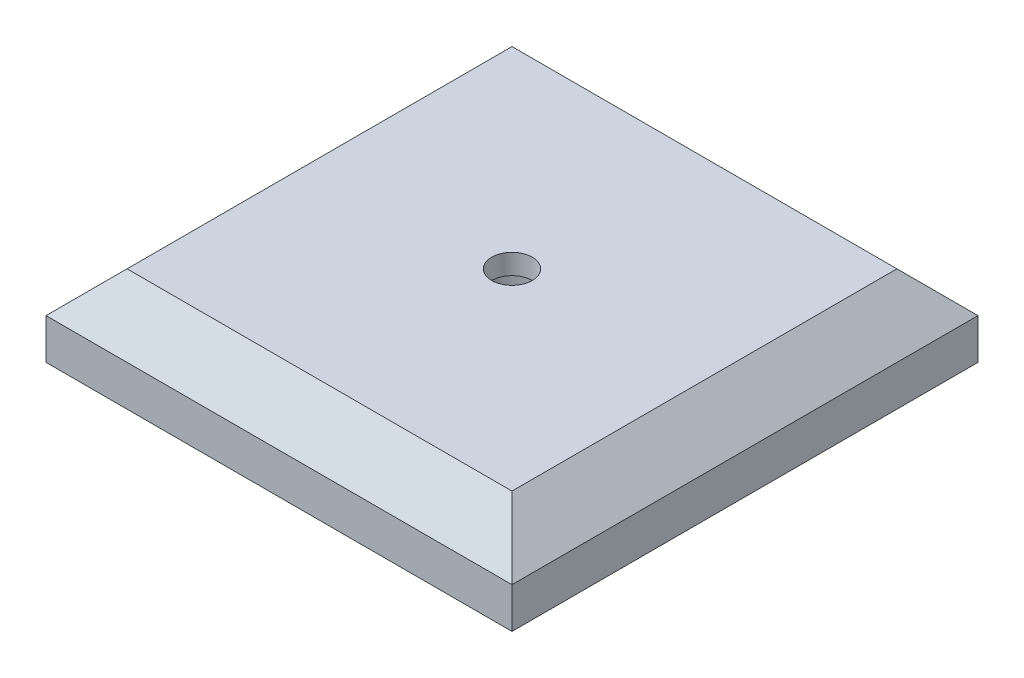
from build123d import *

# Parameters (mm, degrees)
SKETCH1_W           = 2.875
SKETCH1_H           = 2.875
BOSS_EXTRUDE1_DEPTH = 0.5
SKETCH2_R           = 0.125
CUT_EXTRUDE1_DEPTH  = 0.125
SKETCH3_R           = 0.25
CUT_EXTRUDE2_DEPTH  = 0.375
CHAMFER2_SIZE       = 0.25


with BuildPart() as part:
    # Sketch1 → Boss-Extrude1 (new body)
    with BuildSketch(Plane(origin=(0, 0, 0), x_dir=(1, 0, 0), z_dir=(0, 1, 0))):
        Rectangle(SKETCH1_W, SKETCH1_H)
    extrude(amount=BOSS_EXTRUDE1_DEPTH)

    # Sketch2 → Cut-Extrude1 (cut)
    with BuildSketch(Plane(origin=(0, 0.5, 0), x_dir=(1, 0, 0), z_dir=(0, 1, 0))):
        with Locations(Location((0, 0, 0), (0, 0, 270))):
            Circle(SKETCH2_R)
    extrude(amount=-CUT_EXTRUDE1_DEPTH, mode=Mode.SUBTRACT)

    # Sketch3 → Cut-Extrude2 (cut)
    with BuildSketch(Plane.XZ):
        with Locations(Location((0, 0, 0), (0, 0, 270))):
            Circle(SKETCH3_R)
    extrude(amount=-CUT_EXTRUDE2_DEPTH, mode=Mode.SUBTRACT)

    # Chamfer2
    chamfer2_edges = [part.edges().sort_by_distance(p)[0] for p in [
        (-1.4375, 0.5, 0),
        (0, 0.5, 1.4375),
        (1.4375, 0.5, 0),
        (0, 0.5, -1.4375),
    ]]
    chamfer(chamfer2_edges, length=CHAMFER2_SIZE)


solid = part.part
